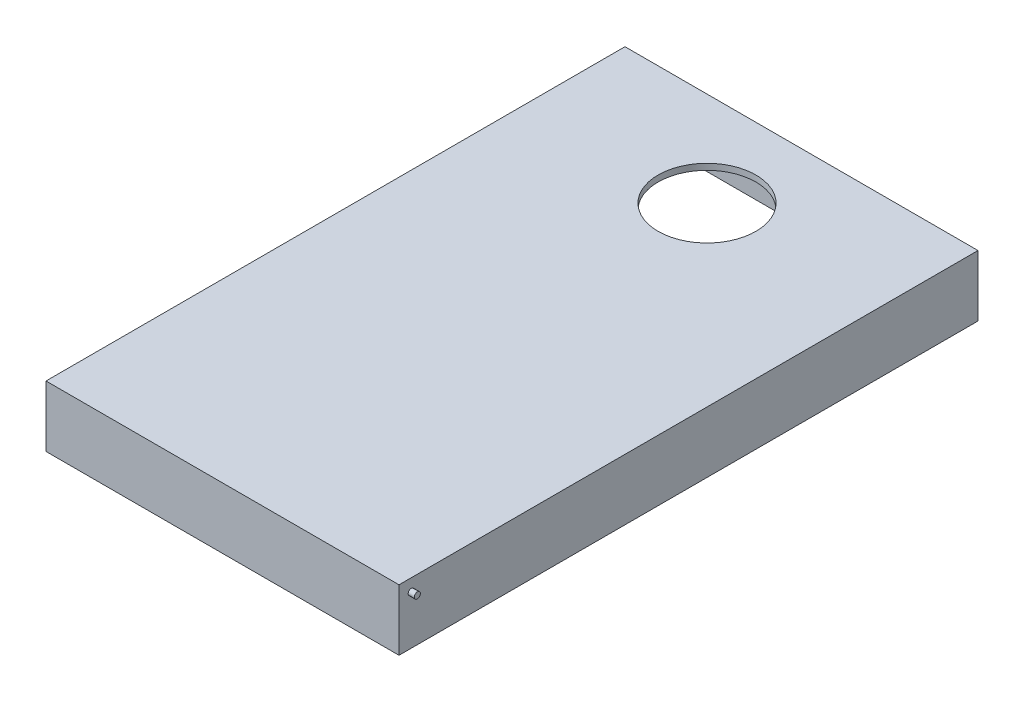
from build123d import *

# Parameters (mm, degrees)
SKETCH2_W           = 57.8
SKETCH2_H           = 94.8
BOSS_EXTRUDE1_DEPTH = 10
SHELL1_T            = -1
SKETCH3_R           = 8
CUT_EXTRUDE1_DEPTH  = 123.683699502
SKETCH4_R           = 0.5
BOSS_EXTRUDE2_DEPTH = 1


with BuildPart() as part:
    # Sketch2 → Boss-Extrude1 (new body)
    with BuildSketch(Plane(origin=(0, 0, 0), x_dir=(1, 0, 0), z_dir=(0, 1, 0))):
        with Locations((0, 71.411111111)):
            Rectangle(SKETCH2_W, SKETCH2_H)
    extrude(amount=-BOSS_EXTRUDE1_DEPTH)

    # Shell1
    shell1_openings = [part.faces().sort_by_distance(p)[0] for p in [
        (0, -10, -71.411111111),
    ]]
    offset(amount=SHELL1_T, openings=shell1_openings, kind=Kind.INTERSECTION)

    # Sketch3 → Cut-Extrude1 (cut, through all)
    with BuildSketch(Plane(origin=(0, 0, 0), x_dir=(1, 0, 0), z_dir=(0, 1, 0))):
        with Locations(Location((0, 103.340669908, 0), (0, 0, 270))):
            Circle(SKETCH3_R)
    extrude(amount=-CUT_EXTRUDE1_DEPTH, mode=Mode.SUBTRACT)

    # Sketch4 → Boss-Extrude2 (add)
    with BuildSketch(Plane(origin=(28.9, 0, 0), x_dir=(0, 0, -1), z_dir=(1, 0, 0))):
        with Locations((26.011111111, -2)):
            Circle(SKETCH4_R)
    boss_extrude2 = extrude(amount=BOSS_EXTRUDE2_DEPTH)

    # Mirror1: Boss-Extrude2 across plane
    add(boss_extrude2.mirror(Plane(origin=(0, 0, 0), x_dir=(0, 0, 1), z_dir=(1, 0, 0))))


solid = part.part
